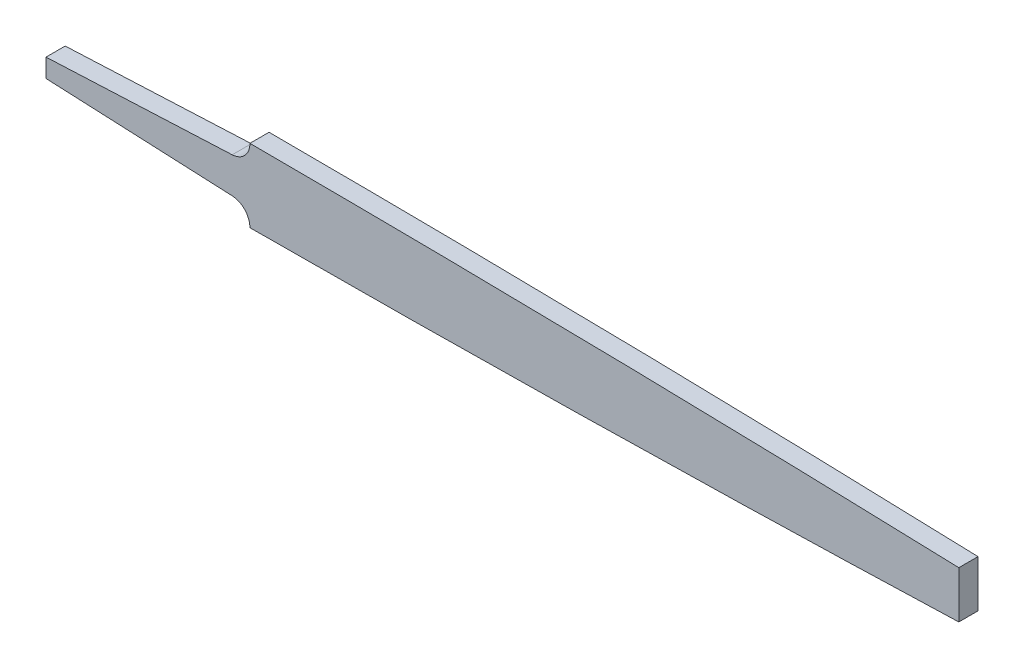
from build123d import *

# Parameters (mm, degrees)
BOSS_EXTRUDE1_DEPTH      = 2.07
BOSS_EXTRUDE1_DEPTH_BACK = 2.07


with BuildPart() as part:
    # Sketch1 → Boss-Extrude1 (new, two sides: drawn at the far end of the back side and taken through both)
    with BuildSketch(Plane.XY.offset(-BOSS_EXTRUDE1_DEPTH_BACK)):
        with BuildLine():
            Line((-98.5, -2), (-98.5, 2))
            Line((-98.5, 2), (-58.317523483, 3.835))
            ThreePointArc((-58.317523483, 3.835), (-55.607777146, 5.067676748), (-54.5, 7.830835622))
            Line((-54.5, 7.830835622), (-54.5, 7.885))
            add(Edge.make_bspline(
                [(-54.5, 7.885), (22.028887168, 7.680718763), (98.5, 5.075)],
                knots=[0, 0, 0, 1, 1, 1], degree=2))
            Line((98.5, 5.075), (98.5, -5.075))
            add(Edge.make_bspline(
                [(-54.5, -7.885), (22.028887168, -7.680718763), (98.5, -5.075)],
                knots=[0, 0, 0, 1, 1, 1], degree=2))
            Line((-54.5, -7.885), (-54.5, -7.830835622))
            ThreePointArc((-54.5, -7.830835622), (-55.607777146, -5.067676748), (-58.317523483, -3.835))
            Line((-58.317523483, -3.835), (-98.5, -2))
        make_face()
    extrude(amount=BOSS_EXTRUDE1_DEPTH + BOSS_EXTRUDE1_DEPTH_BACK)


solid = part.part
